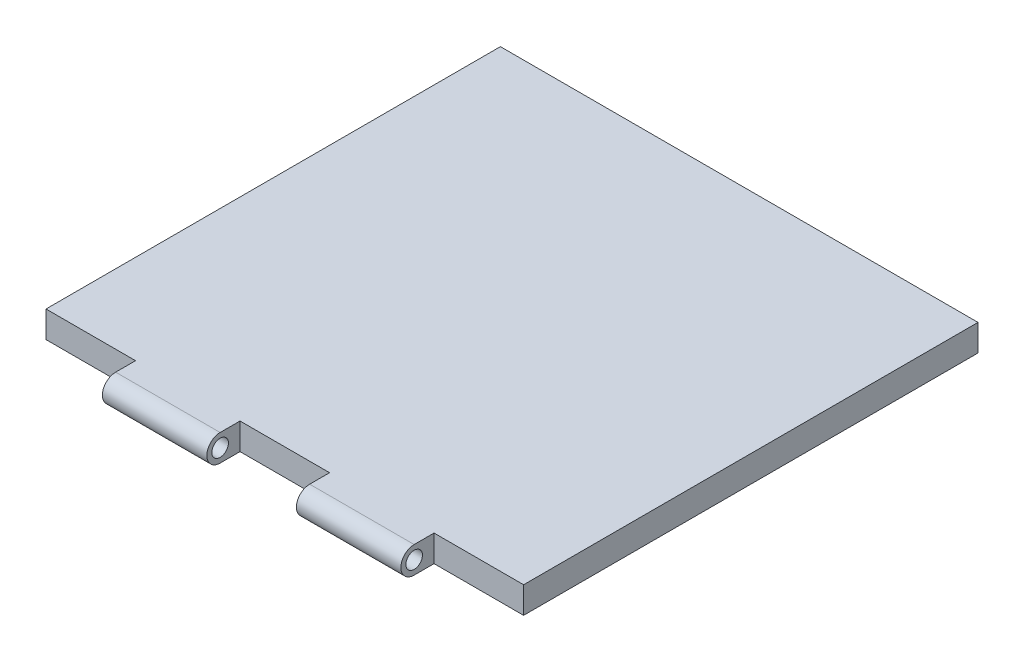
from build123d import *

# Parameters (mm, degrees)
SKETCH3_R               = 1.25
BOSS_EXTRUDE2_DEPTH     = 36
CUT_EXTRUDE1_DEPTH      = 53.24200467
CUT_EXTRUDE1_DEPTH_BACK = 53.24200467
SKETCH4_W               = 13.5
SKETCH4_H               = 5
BOSS_EXTRUDE3_DEPTH     = 30


with BuildPart() as part:
    # Sketch3 → Boss-Extrude2 (new, symmetric)
    with BuildSketch(Plane(origin=(0, 0, 0), x_dir=(0, 0, -1), z_dir=(1, 0, 0))):
        with BuildLine():
            Line((-35.75, 2.857368006), (35.75, 2.857368006))
            Line((35.75, 2.857368006), (35.75, -1.142631994))
            Line((35.75, -1.142631994), (-35.75, -1.142631994))
            ThreePointArc((-35.75, -1.142631994), (-37.75, 0.857368006), (-35.75, 2.857368006))
        make_face()
        with Locations((-35.75, 0.857368006)):
            Circle(SKETCH3_R, mode=Mode.SUBTRACT)
    extrude(amount=BOSS_EXTRUDE2_DEPTH, both=True)

    # Sketch4 → Cut-Extrude1 (cut, two sides: drawn at the far end of the back side and taken through both)
    with BuildSketch(Plane(origin=(0, 0, 0), x_dir=(1, 0, 0), z_dir=(0, 1, 0)).offset(-CUT_EXTRUDE1_DEPTH_BACK)):
        with Locations((-29.25, -35.25)):
            Rectangle(SKETCH4_W, SKETCH4_H)
        with Locations((29.25, -35.25)):
            Rectangle(SKETCH4_W, SKETCH4_H)
        with Locations((0, -35.25)):
            Rectangle(SKETCH4_W, SKETCH4_H)
    extrude(amount=CUT_EXTRUDE1_DEPTH + CUT_EXTRUDE1_DEPTH_BACK, mode=Mode.SUBTRACT)

    # Sketch7 → Boss-Extrude3 (add, symmetric)
    with BuildSketch(Plane(origin=(0, 0, 0), x_dir=(0, 0, -1), z_dir=(1, 0, 0))):
        Polygon((30.876330293, -1.142631994), (30.876330293, -3.878672559), (19.808295325, -1.142631994), align=None)
    extrude(amount=BOSS_EXTRUDE3_DEPTH, both=True)


solid = part.part
